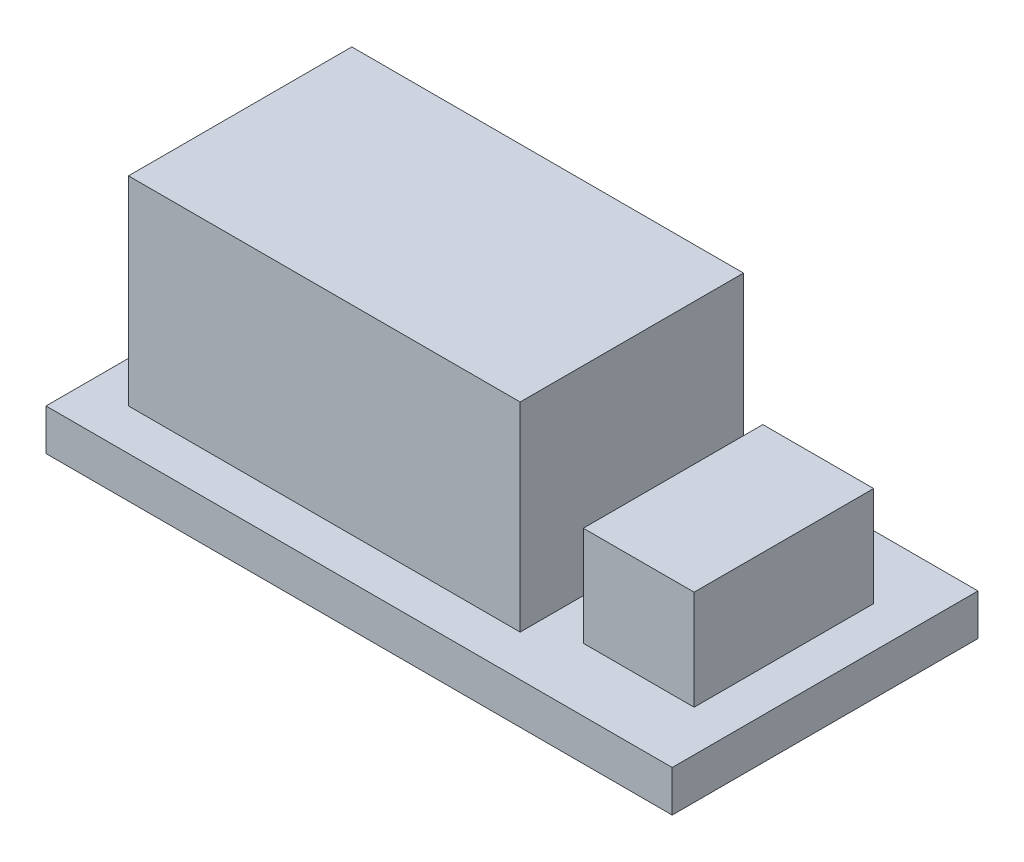
from build123d import *

# Parameters (mm, degrees)
SKETCH1_W           = 2895.6
SKETCH1_H           = 1651
BOSS_EXTRUDE1_DEPTH = 1473.2
SKETCH2_W           = 819.15
SKETCH2_H           = 1327.15
BOSS_EXTRUDE2_DEPTH = 736.6
SKETCH3_W           = 4629.15
SKETCH3_H           = 2260.6
BOSS_EXTRUDE3_DEPTH = 304.8


with BuildPart() as part:
    # Sketch1 → Boss-Extrude1 (new body)
    with BuildSketch(Plane(origin=(0, 0, 0), x_dir=(1, 0, 0), z_dir=(0, 1, 0))):
        Rectangle(SKETCH1_W, SKETCH1_H)
    extrude(amount=BOSS_EXTRUDE1_DEPTH)


with BuildPart() as body_2:
    # Sketch2 → Boss-Extrude2 (new body)
    with BuildSketch(Plane.XZ):
        with Locations((2162.175, 0)):
            Rectangle(SKETCH2_W, SKETCH2_H)
    extrude(amount=-BOSS_EXTRUDE2_DEPTH)


with BuildPart() as body_3:
    # Sketch3 → Boss-Extrude3 (new body)
    with BuildSketch(Plane.XZ):
        with Locations((561.975, 0)):
            Rectangle(SKETCH3_W, SKETCH3_H)
    extrude(amount=BOSS_EXTRUDE3_DEPTH)


solid = Compound([part.part, body_2.part, body_3.part])
